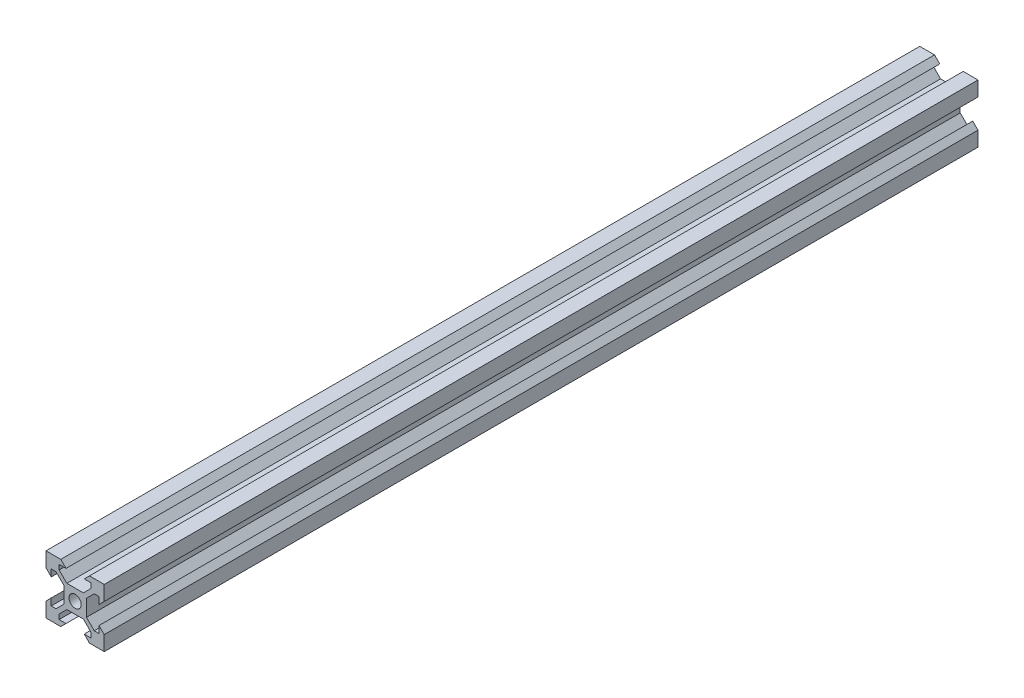
from build123d import *

# Parameters (mm, degrees)
SKETCH1_R           = 2.1
BOSS_EXTRUDE1_DEPTH = 150


with BuildPart() as part:
    # Sketch1 → Boss-Extrude1 (new, symmetric)
    with BuildSketch(Plane.XY):
        Polygon((-10, -4.925), (-10, -10), (-4.925, -10), (-3.125, -8.2), (-5.5, -8.2), (-5.5, -6.560660172), (-2.839339828, -3.9), (2.839339828, -3.9), (5.5, -6.560660172), (5.5, -8.2), (3.125, -8.2), (4.925, -10), (10, -10), (10, -4.925), (8.2, -3.125), (8.2, -5.5), (6.560660172, -5.5), (3.9, -2.839339828), (3.9, 2.839339828), (6.560660172, 5.5), (8.2, 5.5), (8.2, 3.125), (10, 4.925), (10, 10), (4.925, 10), (3.125, 8.2), (5.5, 8.2), (5.5, 6.560660172), (2.839339828, 3.9), (-2.839339828, 3.9), (-5.5, 6.560660172), (-5.5, 8.2), (-3.125, 8.2), (-4.925, 10), (-10, 10), (-10, 4.925), (-8.2, 3.125), (-8.2, 5.5), (-6.560660172, 5.5), (-3.9, 2.839339828), (-3.9, -2.839339828), (-6.560660172, -5.5), (-8.2, -5.5), (-8.2, -3.125), align=None)
        Circle(SKETCH1_R, mode=Mode.SUBTRACT)
    extrude(amount=BOSS_EXTRUDE1_DEPTH, both=True)


solid = part.part
